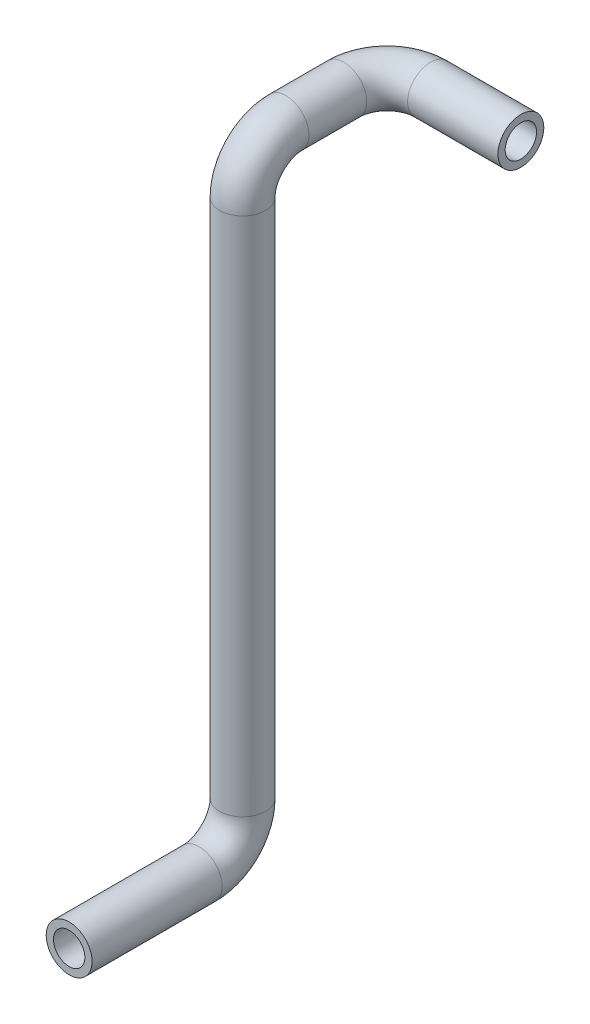
from build123d import *

# Parameters (mm, degrees)
TUBE_PROFILE_R   = 3.175
TUBE_PROFILE_R_2 = 2.175


with BuildPart() as part:
    # Tube: sweep along a curve in space
    with BuildLine() as tube_path:
        Line((-131.5, 100, 50), (-144, 100, 50))
        ThreePointArc((-150, 100, 56), (-148.242640687, 100, 51.757359313), (-144, 100, 50))
        Line((-150, 100, 56), (-150, 100, 64))
        ThreePointArc((-150, 94, 70), (-150, 98.242640687, 68.242640687), (-150, 100, 64))
        Line((-150, 94, 70), (-150, 22, 70))
        ThreePointArc((-150, 16, 76), (-150, 17.757359313, 71.757359313), (-150, 22, 70))
        Line((-150, 16, 76), (-150, 16, 94))
    # Tube profile (on start of the path) → Tube (sweep)
    with BuildSketch(Plane(origin=(-131.5, 100, 50), x_dir=(0, 0, -1), z_dir=(-1, 0, 0))):
        Circle(TUBE_PROFILE_R)
        Circle(TUBE_PROFILE_R_2, mode=Mode.SUBTRACT)
    sweep(path=tube_path.line)


solid = part.part
